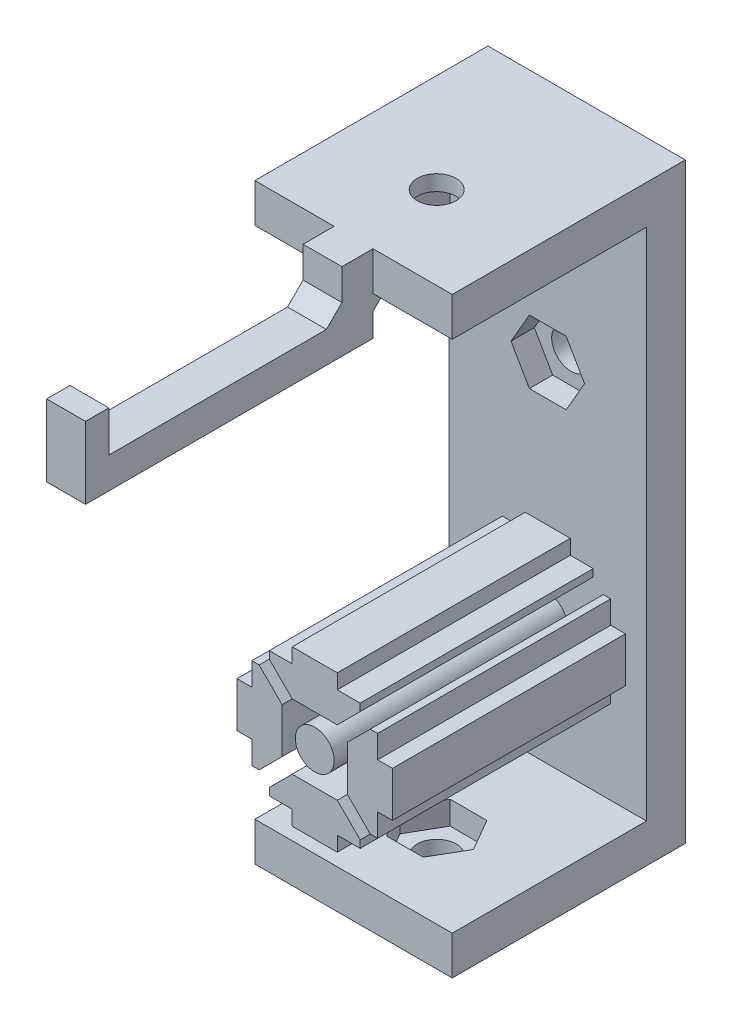
from build123d import *

# Parameters (mm, degrees)
SKETCH1_W           = 25.4
SKETCH1_H           = 76.2
SKETCH1_R           = 2.5
BOSS_EXTRUDE1_DEPTH = 5
BOSS_EXTRUDE2_START = 38.1
SKETCH3_W           = 25.4
SKETCH3_H           = 25
SKETCH3_R           = 2.5
BOSS_EXTRUDE2_DEPTH = 5
BOSS_EXTRUDE3_START = -33.1
SKETCH3_5_W         = 25.4
SKETCH3_5_H         = 25
SKETCH3_5_R         = 2.5
BOSS_EXTRUDE3_DEPTH = 5
CUT_EXTRUDE1_START  = -3
CUT_EXTRUDE1_DEPTH  = 72.2
SKETCH5_R           = 2.5
BOSS_EXTRUDE4_DEPTH = 30
CUT_EXTRUDE2_DEPTH  = 3
SKETCH7_W           = 4
SKETCH7_H           = 10
SKETCH7_W_2         = 30
SKETCH7_H_2         = 4
SKETCH7_W_3         = 3
SKETCH7_H_3         = 9.256727868
BOSS_EXTRUDE5_DEPTH = 2.5
CHAMFER1_SIZE       = 2


with BuildPart() as part:
    # Sketch1 → Boss-Extrude1 (new body)
    with BuildSketch(Plane.XY):
        Rectangle(SKETCH1_W, SKETCH1_H)
        with Locations((0, 11.68)):
            Circle(SKETCH1_R, mode=Mode.SUBTRACT)
    extrude(amount=BOSS_EXTRUDE1_DEPTH)

    # Sketch3 → Boss-Extrude2 (add)
    with BuildSketch(Plane(origin=(0, 0, 0), x_dir=(1, 0, 0), z_dir=(0, 1, 0)).offset(BOSS_EXTRUDE2_START)):
        with Locations((0, -17.5)):
            Rectangle(SKETCH3_W, SKETCH3_H)
        with Locations(Location((0, -19.304, 0), (0, 0, 90))):
            Circle(SKETCH3_R, mode=Mode.SUBTRACT)
    extrude(amount=-BOSS_EXTRUDE2_DEPTH)

    # Sketch3<5> → Boss-Extrude3 (add)
    with BuildSketch(Plane(origin=(0, 0, 0), x_dir=(1, 0, 0), z_dir=(0, 1, 0)).offset(BOSS_EXTRUDE3_START)):
        with Locations((0, -17.5)):
            Rectangle(SKETCH3_5_W, SKETCH3_5_H)
        with Locations(Location((0, -19.304, 0), (0, 0, 90))):
            Circle(SKETCH3_5_R, mode=Mode.SUBTRACT)
    extrude(amount=-BOSS_EXTRUDE3_DEPTH)

    # Sketch4 → Cut-Extrude1 (cut)
    with BuildSketch(Plane.XZ.offset(-33.1).offset(CUT_EXTRUDE1_START)):
        Polygon((2.367136104, 15.204), (4.734272207, 19.304), (2.367136104, 23.404), (-2.367136104, 23.404), (-4.734272207, 19.304), (-2.367136104, 15.204), align=None)
    extrude(amount=CUT_EXTRUDE1_DEPTH, mode=Mode.SUBTRACT)

    # Sketch5 → Boss-Extrude4 (add)
    with BuildSketch(Plane.XY.offset(5)):
        with Locations((0, -16.479)):
            Circle(SKETCH5_R)
        Polygon((-2.9, -12.279), (2.9, -12.279), (5.85, -9.329), (5.85, -8.379), (2.9, -8.379), (2.9, -6.479), (-2.9, -6.479), (-2.9, -8.379), (-5.85, -8.379), (-5.85, -9.329), align=None)
        Polygon((4.2, -13.579), (4.2, -19.379), (7.15, -22.329), (8.1, -22.329), (8.1, -19.379), (10, -19.379), (10, -13.579), (8.1, -13.579), (8.1, -10.629), (7.15, -10.629), align=None)
        Polygon((2.9, -20.679), (-2.9, -20.679), (-5.85, -23.629), (-5.85, -24.579), (-2.9, -24.579), (-2.9, -26.479), (2.9, -26.479), (2.9, -24.579), (5.85, -24.579), (5.85, -23.629), align=None)
        Polygon((-4.2, -19.379), (-4.2, -13.579), (-7.15, -10.629), (-8.1, -10.629), (-8.1, -13.579), (-10, -13.579), (-10, -19.379), (-8.1, -19.379), (-8.1, -22.329), (-7.15, -22.329), align=None)
    extrude(amount=BOSS_EXTRUDE4_DEPTH)

    # Sketch6 → Cut-Extrude2 (cut)
    with BuildSketch(Plane.XY.offset(5)):
        Polygon((2.367136104, 7.58), (4.734272207, 11.68), (2.367136104, 15.78), (-2.367136104, 15.78), (-4.734272207, 11.68), (-2.367136104, 7.58), align=None)
    extrude(amount=-CUT_EXTRUDE2_DEPTH, mode=Mode.SUBTRACT)

    # Sketch7 → Boss-Extrude5 (add, symmetric)
    with BuildSketch(Plane(origin=(0, 0, 0), x_dir=(0, 0, -1), z_dir=(1, 0, 0))):
        with Locations((-32, 33.1)):
            Rectangle(SKETCH7_W, SKETCH7_H)
        with Locations((-49, 30.1)):
            Rectangle(SKETCH7_W_2, SKETCH7_H_2)
        with Locations((-65.5, 32.728363934)):
            Rectangle(SKETCH7_W_3, SKETCH7_H_3)
    extrude(amount=BOSS_EXTRUDE5_DEPTH, both=True)

    # Chamfer1
    chamfer1_edges = [part.edges().sort_by_distance(p)[0] for p in [
        (0, 33.1, 30),
        (0, 32.1, 34),
    ]]
    chamfer(chamfer1_edges, length=CHAMFER1_SIZE)


solid = part.part
